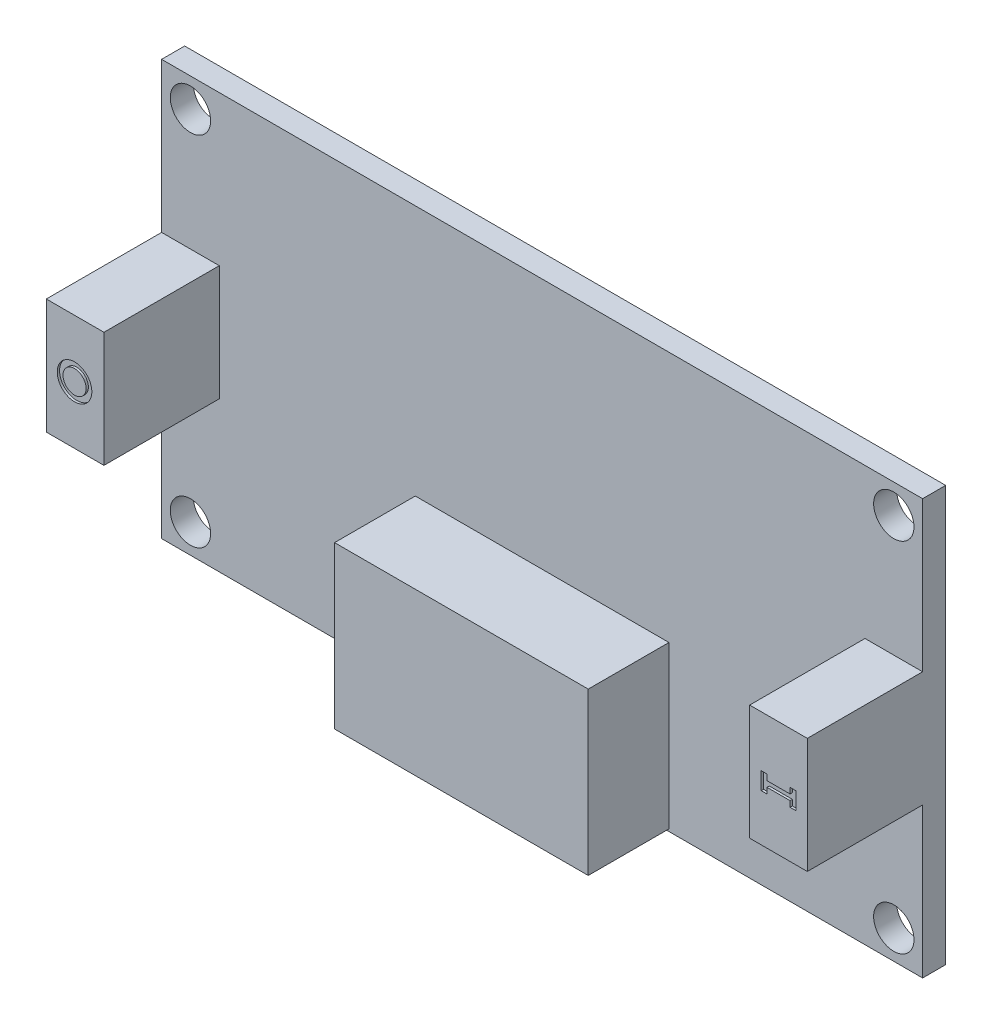
from build123d import *

# Parameters (mm, degrees)
SKETCH_1_W          = 66
SKETCH_1_H          = 36
SKETCH_1_R          = 1.75
EXTRUDE_1_DEPTH     = 2
SKETCH_2_W          = 22
SKETCH_2_H          = 14
EXTRUDE_2_DEPTH     = 7
SKETCH_3_W          = 5
SKETCH_3_H          = 10
EXTRUDE_3_DEPTH     = 10
CUT_EXTRUDE_1_DEPTH = 0.2
SKETCH_5_R          = 1.5
SKETCH_5_R_2        = 1
CUT_EXTRUDE_2_DEPTH = 0.2


with BuildPart() as part:
    # 草图1 → 凸台-拉伸1 (new body)
    with BuildSketch(Plane.XY):
        Rectangle(SKETCH_1_W, SKETCH_1_H)
        with Locations((30.5, 15.5)):
            Circle(SKETCH_1_R, mode=Mode.SUBTRACT)
        with Locations(Location((30.5, -15.5, 0), (0, 0, 180))):
            Circle(SKETCH_1_R, mode=Mode.SUBTRACT)
        with Locations((-30.5, -15.5)):
            Circle(SKETCH_1_R, mode=Mode.SUBTRACT)
        with Locations(Location((-30.5, 15.5, 0), (0, 0, 180))):
            Circle(SKETCH_1_R, mode=Mode.SUBTRACT)
    extrude(amount=EXTRUDE_1_DEPTH)

    # 草图2 → 凸台-拉伸2 (add)
    with BuildSketch(Plane.XY.offset(2)):
        with Locations((0, -10.8)):
            Rectangle(SKETCH_2_W, SKETCH_2_H)
    extrude(amount=EXTRUDE_2_DEPTH)

    # 草图3 → 凸台-拉伸3 (add)
    with BuildSketch(Plane.XY.offset(2)):
        with Locations((-30.5, 0)):
            Rectangle(SKETCH_3_W, SKETCH_3_H)
        with Locations((30.5, 0)):
            Rectangle(SKETCH_3_W, SKETCH_3_H)
    extrude(amount=EXTRUDE_3_DEPTH)

    # 草图4 → 切除-拉伸1 (cut)
    with BuildSketch(Plane.XY.offset(12)):
        Polygon((29, 0.571414009), (29, -0.928585991), (29.5, -0.928585991), (29.5, -0.428585991), (31.5, -0.428585991), (31.5, -0.928585991), (32, -0.928585991), (32, 0.571414009), (31.5, 0.571414009), (31.5, 0.071414009), (29.5, 0.071414009), (29.5, 0.571414009), align=None)
    extrude(amount=-CUT_EXTRUDE_1_DEPTH, mode=Mode.SUBTRACT)

    # 草图5 → 切除-拉伸2 (cut)
    with BuildSketch(Plane.XY.offset(12)):
        with Locations((-30.551618455, 0)):
            Circle(SKETCH_5_R)
        with Locations((-30.551618455, 0)):
            Circle(SKETCH_5_R_2, mode=Mode.SUBTRACT)
    extrude(amount=-CUT_EXTRUDE_2_DEPTH, mode=Mode.SUBTRACT)


solid = part.part
